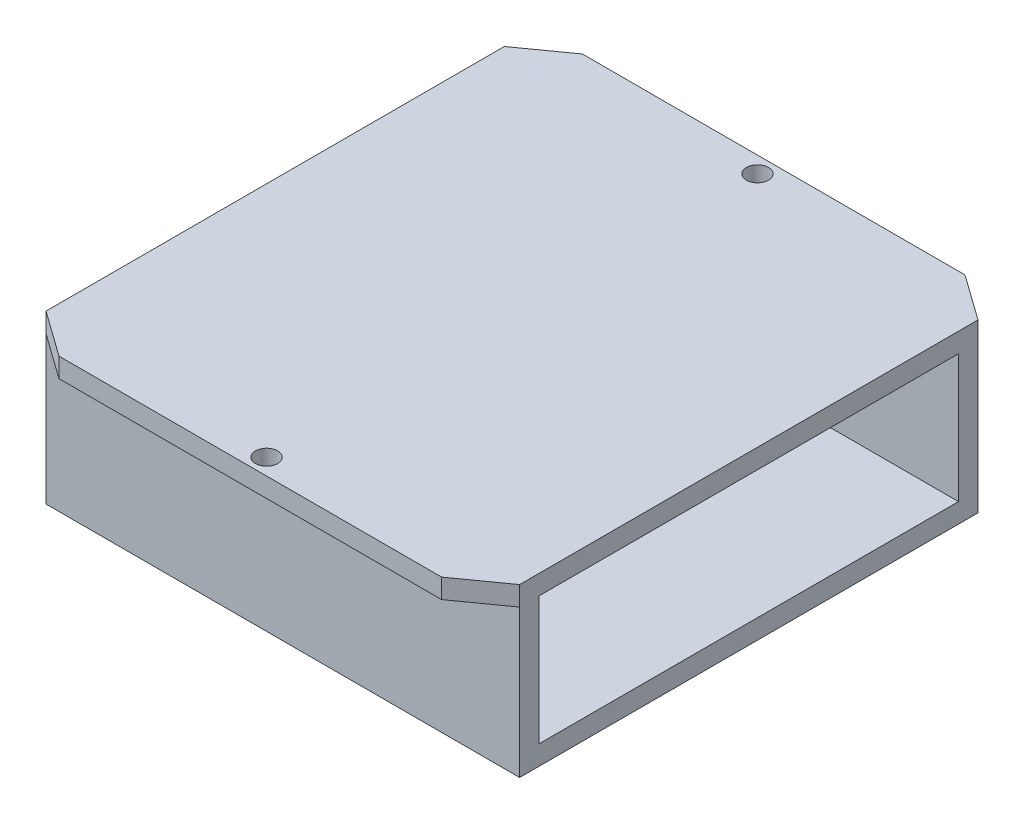
from build123d import *

# Parameters (mm, degrees)
SKETCH2_W           = 70.5
SKETCH2_H           = 25.7
SKETCH2_W_2         = 64.5
SKETCH2_H_2         = 19.7
BOSS_EXTRUDE1_DEPTH = 69.85
SKETCH3_W           = 70.5
SKETCH3_H           = 25.7
BOSS_EXTRUDE2_DEPTH = 3
SKETCH4_R           = 1.7
BOSS_EXTRUDE3_DEPTH = 3


with BuildPart() as part:
    # Sketch2 → Boss-Extrude1 (new body)
    with BuildSketch(Plane(origin=(0, 0, 0), x_dir=(0, 0, -1), z_dir=(1, 0, 0))):
        with Locations((32.25, 9.85)):
            Rectangle(SKETCH2_W, SKETCH2_H)
        with Locations((32.25, 9.85)):
            Rectangle(SKETCH2_W_2, SKETCH2_H_2, mode=Mode.SUBTRACT)
    extrude(amount=BOSS_EXTRUDE1_DEPTH)

    # Sketch3 → Boss-Extrude2 (add)
    with BuildSketch(Plane.ZY):
        with Locations((-32.25, 9.85)):
            Rectangle(SKETCH3_W, SKETCH3_H)
    extrude(amount=BOSS_EXTRUDE2_DEPTH)

    # Sketch4 → Boss-Extrude3 (add)
    # profile 1 of 2: a face of its own
    with BuildSketch(Plane(origin=(0, 22.7, 0), x_dir=(1, 0, 0), z_dir=(0, 1, 0))):
        Polygon((69.85, 67.5), (62.85, 72.5), (4, 72.5), (-3, 67.5), align=None)
        with Locations(Location((33.425, 70, 0), (0, 0, 270))):
            Circle(SKETCH4_R, mode=Mode.SUBTRACT)
    # profile 2 of 2: a face of its own
    with BuildSketch(Plane(origin=(0, 22.7, 0), x_dir=(1, 0, 0), z_dir=(0, 1, 0))):
        Polygon((-3, -3), (69.85, -3), (62.85, -8), (4, -8), align=None)
        with Locations(Location((33.425, -5.5, 0), (0, 0, 90))):
            Circle(SKETCH4_R, mode=Mode.SUBTRACT)
    extrude(amount=-BOSS_EXTRUDE3_DEPTH)


solid = part.part
